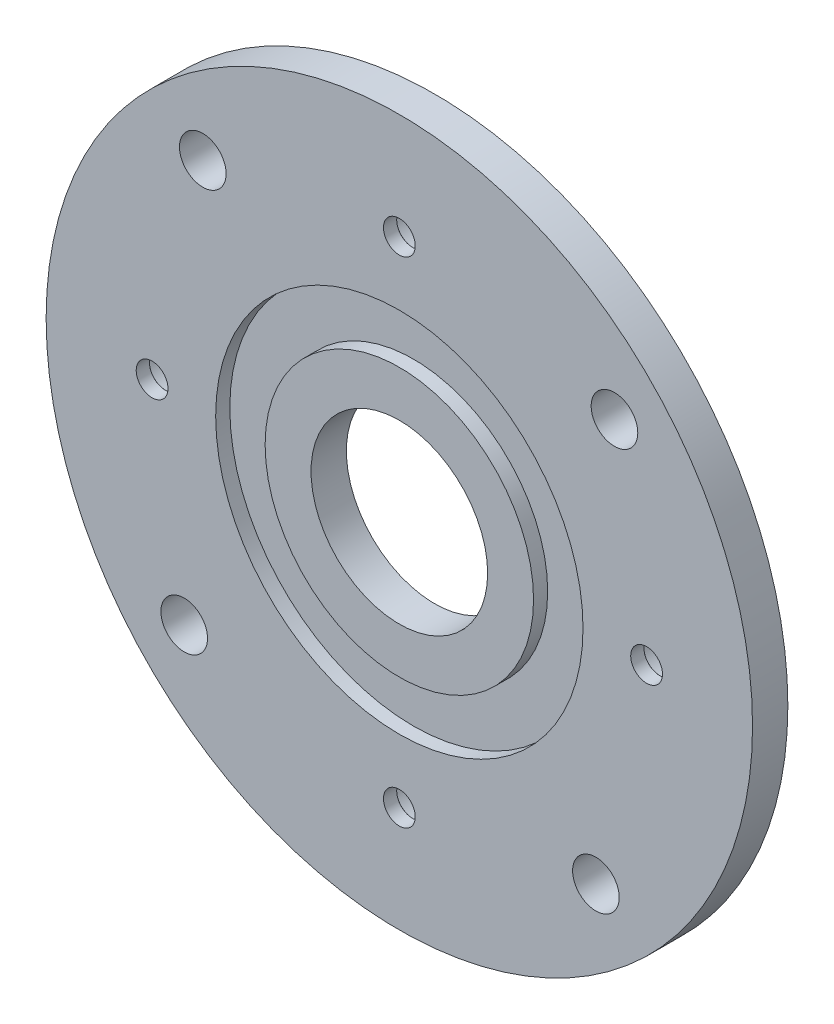
from build123d import *

# Parameters (mm, degrees)
ESQUISSE1_R                                = 50
BOSS_EXTRU_1_DEPTH                         = 5
ESQUISSE2_R                                = 26
ESQUISSE2_R_2                              = 19
ENL_V_MAT_EXTRU_1_DEPTH                    = 2
ESQUISSE3_R                                = 12.5
ENL_V_MAT_EXTRU_2_DEPTH                    = 71.887234394
CHAMBRAGE_POUR_VIS_T_TE_RONDE_BOMB_2_COUNT = 2
CHAMBRAGE_POUR_VIS_T_TE_RONDE_BOMB_2_PITCH = 49.497474683
CHAMBRAGE_POUR_VIS_T_TE_RONDE_BOMB_3_COUNT = 2
CHAMBRAGE_POUR_VIS_T_TE_RONDE_BOMB_3_PITCH = 70
CHAMBRAGE_POUR_VIS_T_TE_RONDE_BOMB_4_COUNT = 2
CHAMBRAGE_POUR_VIS_T_TE_RONDE_BOMB_4_PITCH = 49.497474683
D_GAGEMENT_M62_D                           = 6.6


with BuildPart() as part:
    # Esquisse1 → Boss.-Extru.1 (new body)
    with BuildSketch(Plane.XY):
        Circle(ESQUISSE1_R)
    extrude(amount=BOSS_EXTRU_1_DEPTH)

    # Esquisse2 → Enlèv. mat.-Extru.1 (cut)
    with BuildSketch(Plane.XY.offset(5)):
        Circle(ESQUISSE2_R)
        Circle(ESQUISSE2_R_2, mode=Mode.SUBTRACT)
    extrude(amount=-ENL_V_MAT_EXTRU_1_DEPTH, mode=Mode.SUBTRACT)

    # Esquisse3 → Enlèv. mat.-Extru.2 (cut, through all)
    with BuildSketch(Plane.XY.offset(5)):
        Circle(ESQUISSE3_R)
    extrude(amount=-ENL_V_MAT_EXTRU_2_DEPTH, mode=Mode.SUBTRACT)

    # Esquisse5 → Chambrage pour vis à tête ronde bombée M41 (revolve, cut)
    with BuildSketch(Plane(origin=(0, 35, 0), x_dir=(0, 1, 0), z_dir=(1, 0, 0))):
        Polygon((0, 0), (0, 5), (2.25, 5), (2.25, 3.125), (2.275, 3.1), (4.5, 3.1), (4.5, 0), align=None)
    chambrage_pour_vis_t_te_ronde_bomb_e_m = revolve(axis=Axis((0, 35, -6.35), (0, 0, 1)), mode=Mode.SUBTRACT)

    # Chambrage pour vis _ t_te ronde bomb 2: Chambrage pour vis à tête ronde bombée M41 ×2
    with Locations(*[Vector(-0.7071067811865476, -0.7071067811865476, 0) * (i * CHAMBRAGE_POUR_VIS_T_TE_RONDE_BOMB_2_PITCH) for i in range(1, CHAMBRAGE_POUR_VIS_T_TE_RONDE_BOMB_2_COUNT)]):
        add(chambrage_pour_vis_t_te_ronde_bomb_e_m, mode=Mode.SUBTRACT)

    # Chambrage pour vis _ t_te ronde bomb 3: Chambrage pour vis à tête ronde bombée M41 ×2
    with Locations(*[(0, -i * CHAMBRAGE_POUR_VIS_T_TE_RONDE_BOMB_3_PITCH, 0) for i in range(1, CHAMBRAGE_POUR_VIS_T_TE_RONDE_BOMB_3_COUNT)]):
        add(chambrage_pour_vis_t_te_ronde_bomb_e_m, mode=Mode.SUBTRACT)

    # Chambrage pour vis _ t_te ronde bomb 4: Chambrage pour vis à tête ronde bombée M41 ×2
    with Locations(*[Vector(0.7071067811865476, -0.7071067811865476, 0) * (i * CHAMBRAGE_POUR_VIS_T_TE_RONDE_BOMB_4_PITCH) for i in range(1, CHAMBRAGE_POUR_VIS_T_TE_RONDE_BOMB_4_COUNT)]):
        add(chambrage_pour_vis_t_te_ronde_bomb_e_m, mode=Mode.SUBTRACT)

    # Dégagement M62 (through all)
    with Locations(Plane.XY.offset(5)):
        with Locations((30.452660491, 27.824413184), (-27.824413184, 30.452660491), (-30.452660491, -27.824413184), (27.824413184, -30.452660491)):
            Hole(D_GAGEMENT_M62_D / 2)


solid = part.part
